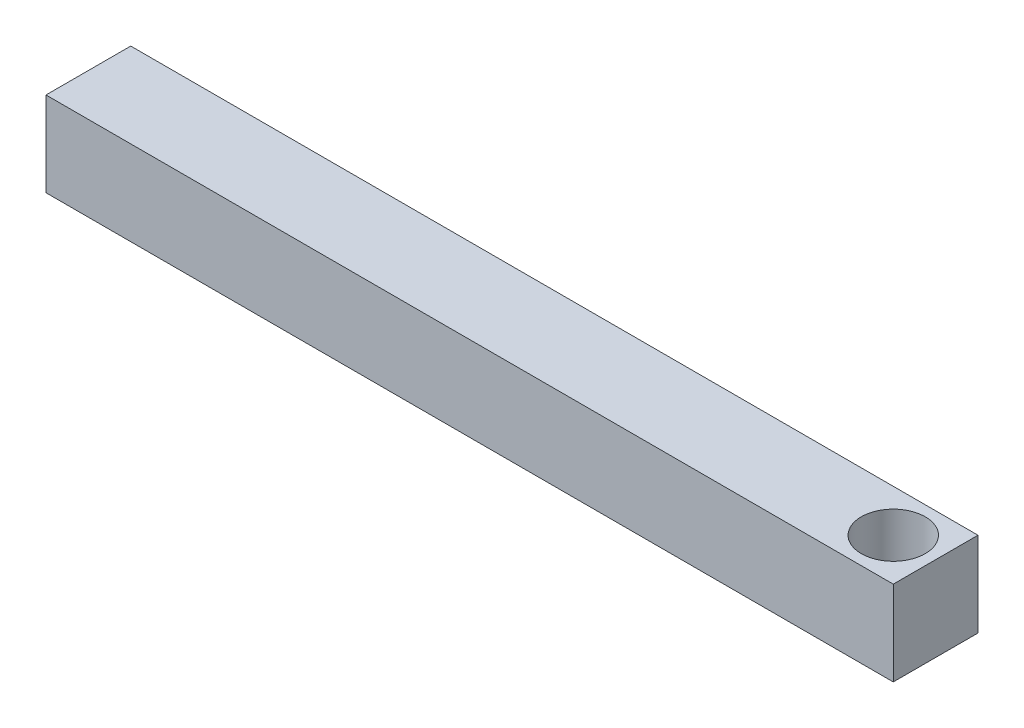
from build123d import *

# Parameters (mm, degrees)
SKETCH1_W           = 127
SKETCH1_H           = 12.7
BOSS_EXTRUDE4_DEPTH = 12.7
SKETCH6_R           = 4.794268816
CUT_EXTRUDE2_DEPTH  = 12.7


with BuildPart() as part:
    # Sketch1 → Boss-Extrude4 (new body)
    with BuildSketch(Plane(origin=(0, 0, 0), x_dir=(1, 0, 0), z_dir=(0, 1, 0))):
        with Locations((23.712411315, 2.337796264)):
            Rectangle(SKETCH1_W, SKETCH1_H)
    extrude(amount=BOSS_EXTRUDE4_DEPTH)

    # Sketch6 → Cut-Extrude2 (cut)
    with BuildSketch(Plane(origin=(0, 12.7, 0), x_dir=(1, 0, 0), z_dir=(0, 1, 0))):
        with Locations(Location((80.862411315, 2.337796264, 0), (0, 0, 270))):
            Circle(SKETCH6_R)
    extrude(amount=-CUT_EXTRUDE2_DEPTH, mode=Mode.SUBTRACT)


solid = part.part
